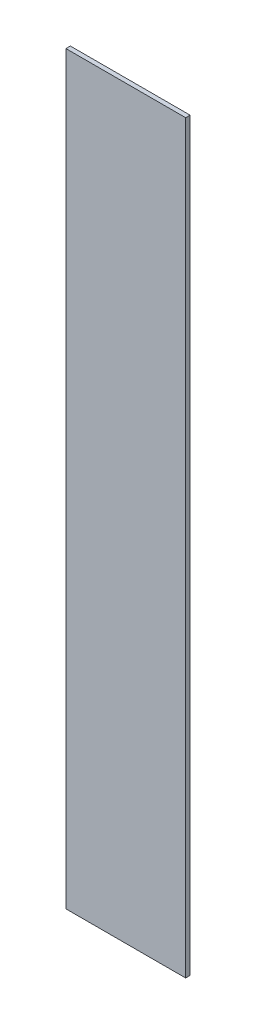
from build123d import *

# Parameters (mm, degrees)
SKETCH1_W           = 342.9
SKETCH1_H           = 2133.6
BOSS_EXTRUDE1_DEPTH = 12.7


with BuildPart() as part:
    # Sketch1 → Boss-Extrude1 (new body)
    with BuildSketch(Plane.XY):
        Rectangle(SKETCH1_W, SKETCH1_H)
    extrude(amount=BOSS_EXTRUDE1_DEPTH)


solid = part.part
